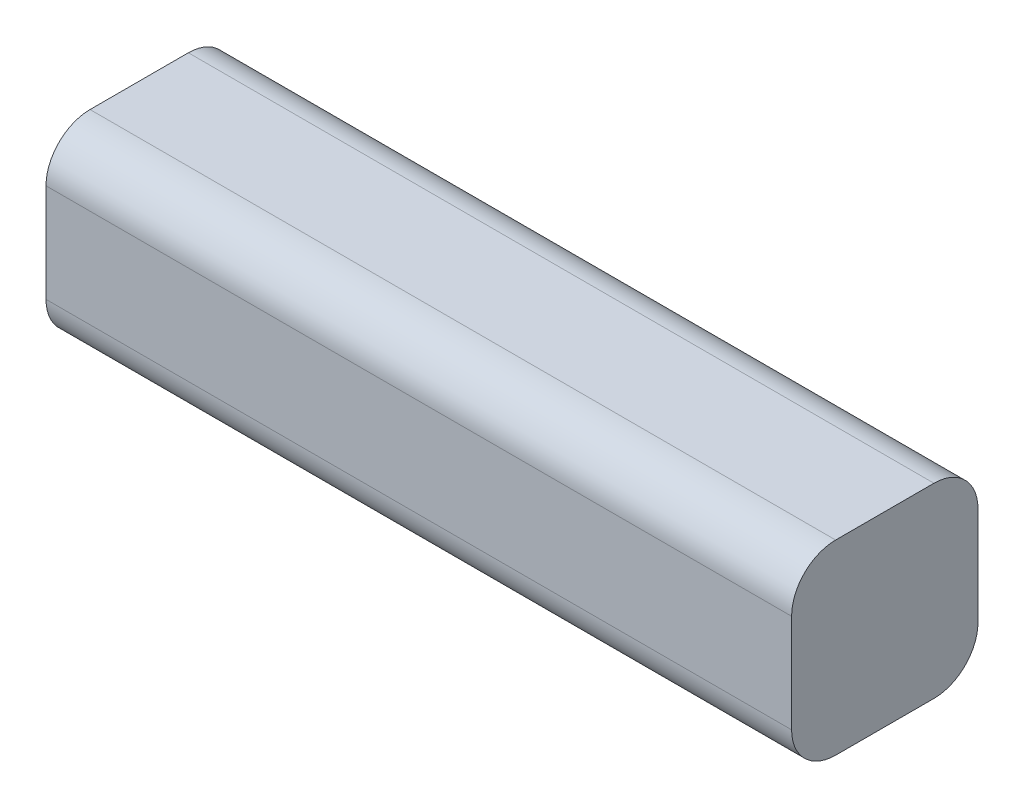
from build123d import *

# Parameters (mm, degrees)
SKETCH1_W           = 152.4
SKETCH1_H           = 38.1
BOSS_EXTRUDE1_DEPTH = 38.1
FILLET1_R           = 9


with BuildPart() as part:
    # Sketch1 → Boss-Extrude1 (new body)
    with BuildSketch(Plane(origin=(0, 0, 0), x_dir=(1, 0, 0), z_dir=(0, 1, 0))):
        with Locations((76.2, 19.05)):
            Rectangle(SKETCH1_W, SKETCH1_H)
    extrude(amount=BOSS_EXTRUDE1_DEPTH)

    # Fillet1
    fillet1_edges = [part.edges().sort_by_distance(p)[0] for p in [
        (76.2, 38.1, -38.1),
        (76.2, 0, -38.1),
        (76.2, 0, 0),
        (76.2, 38.1, 0),
    ]]
    fillet(fillet1_edges, radius=FILLET1_R)


solid = part.part
